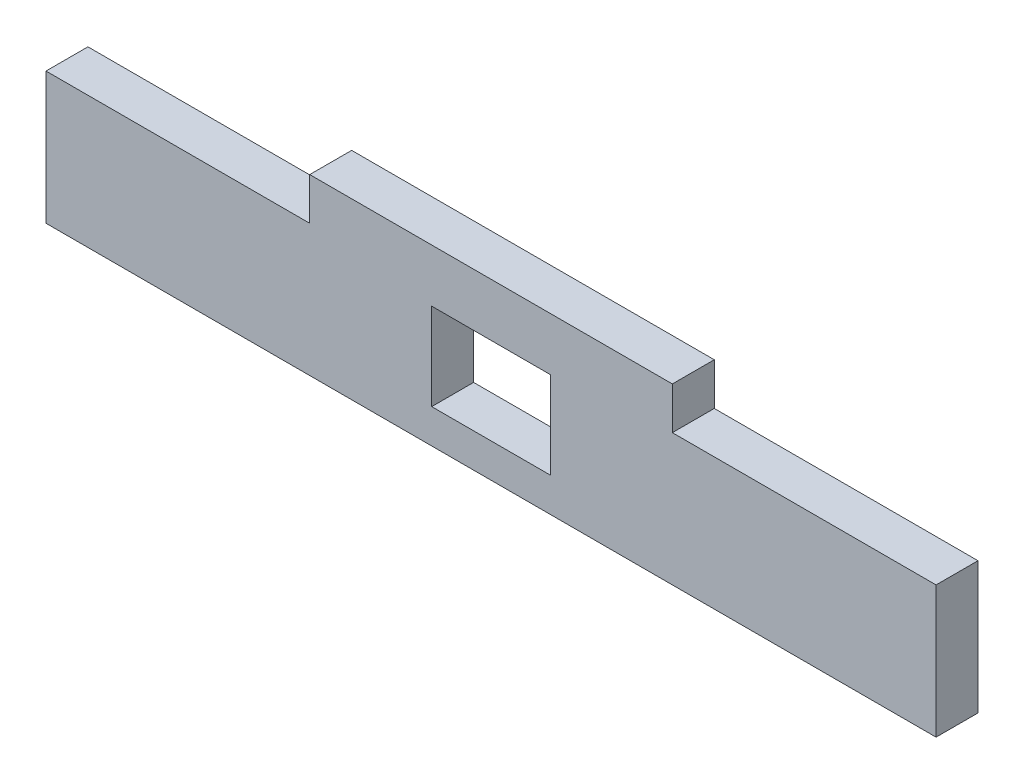
from build123d import *

# Parameters (mm, degrees)
SKETCH1_W           = 11.43
SKETCH1_H           = 8.382
BOSS_EXTRUDE1_DEPTH = 4.0386


with BuildPart() as part:
    # Sketch1 → Boss-Extrude1 (new body)
    with BuildSketch(Plane.XY):
        Polygon((0, 0), (85.725, 0), (85.725, 12.7), (60.325, 12.7), (60.325, 16.764), (25.4, 16.764), (25.4, 12.7), (0, 12.7), align=None)
        with Locations((42.8625, 7.473902875)):
            Rectangle(SKETCH1_W, SKETCH1_H, mode=Mode.SUBTRACT)
    extrude(amount=BOSS_EXTRUDE1_DEPTH)


solid = part.part
